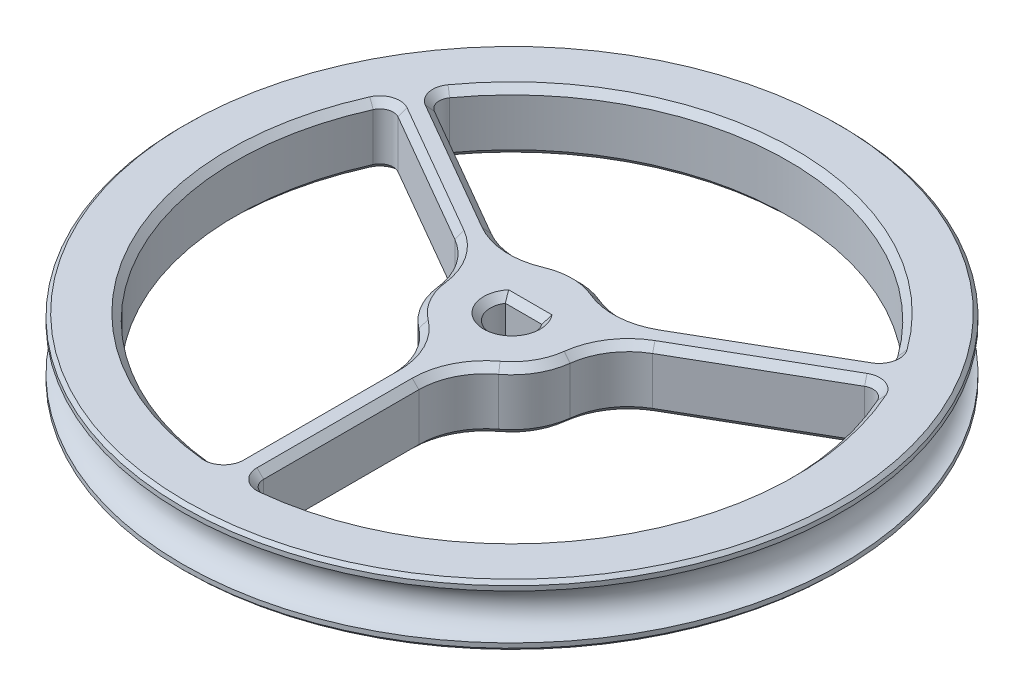
from build123d import *

# Parameters (mm, degrees)
SKETCH1_R           = 24.765
BOSS_EXTRUDE1_DEPTH = 4.572
SKETCH2_R           = 1.7145
CUT_EXTRUDE1_DEPTH  = 36.320159031
CUT_EXTRUDE2_DEPTH  = 36.320159031
CIRPATTERN1_COUNT   = 3
FILLET1_R           = 5
FILLET4_R           = 1
CHAMFER1_SIZE       = 0.5
CHAMFER2_SIZE       = 0.5
CHAMFER3_SIZE       = 0.25


with BuildPart() as part:
    # Sketch1 → Boss-Extrude1 (new body)
    with BuildSketch(Plane(origin=(0, 0, 0), x_dir=(1, 0, 0), z_dir=(0, 1, 0))):
        with Locations(Location((0, 0, 0), (0, 0, 270))):
            Circle(SKETCH1_R)
    extrude(amount=BOSS_EXTRUDE1_DEPTH)

    # Sketch2 → Cut-Revolve1 (revolve, cut)
    with BuildSketch(Plane(origin=(0, 0, 0), x_dir=(0, 0, -1), z_dir=(1, 0, 0))):
        with Locations((25.065, 2.286)):
            Circle(SKETCH2_R)
    revolve(axis=Axis((0, 0, 0), (0, 1, 0)), mode=Mode.SUBTRACT)

    # Sketch3 → Cut-Extrude1 (cut, through all)
    with BuildSketch(Plane(origin=(0, 4.572, 0), x_dir=(1, 0, 0), z_dir=(0, 1, 0))):
        with BuildLine():
            Line((1.372953022, 0.873), (-1.372953022, 0.873))
            ThreePointArc((-1.372953022, 0.873), (0, -1.627), (1.372953022, 0.873))
        make_face()
    extrude(amount=-CUT_EXTRUDE1_DEPTH, mode=Mode.SUBTRACT)

    # Sketch4 → Cut-Extrude2 (cut, through all)
    with BuildSketch(Plane(origin=(0, 4.572, 0), x_dir=(1, 0, 0), z_dir=(0, 1, 0))):
        with BuildLine():
            Line((3.742640687, 3.315515147), (17.462152397, 11.236478926))
            ThreePointArc((17.462152397, 11.236478926), (0, 20.765), (-17.462152397, 11.236478926))
            Line((-17.462152397, 11.236478926), (-3.742640687, 3.315515147))
            ThreePointArc((-3.742640687, 3.315515147), (0, 5), (3.742640687, 3.315515147))
        make_face()
    cut_extrude2 = extrude(amount=-CUT_EXTRUDE2_DEPTH, mode=Mode.SUBTRACT)

    # CirPattern1: Cut-Extrude2 ×3 about axis
    cirpattern1_axis = Axis((0, 0, 0), (0, 1, 0))
    for i in range(1, CIRPATTERN1_COUNT):
        add(cut_extrude2.rotate(cirpattern1_axis, i * 360 / CIRPATTERN1_COUNT), mode=Mode.SUBTRACT)

    # Fillet1
    fillet1_edges = [part.edges().sort_by_distance(p)[0] for p in [
        (3.742640687, 2.286, -3.315515147),
        (-3.742640687, 2.286, -3.315515147),
        (1, 2.286, 4.898979486),
        (4.742640687, 2.286, -1.583464339),
        (-4.742640687, 2.286, -1.583464339),
        (-1, 2.286, 4.898979486),
    ]]
    fillet(fillet1_edges, radius=FILLET1_R)

    # Fillet4
    fillet4_edges = [part.edges().sort_by_distance(p)[0] for p in [
        (-17.462152397, 2.286, -11.236478926),
        (17.462152397, 2.286, -11.236478926),
        (18.462152397, 2.286, -9.504428118),
        (1, 2.286, 20.740907044),
        (-1, 2.286, 20.740907044),
        (-18.462152397, 2.286, -9.504428118),
    ]]
    fillet(fillet4_edges, radius=FILLET4_R)

    # Chamfer1
    chamfer1_edges = [part.edges().sort_by_distance(p)[0] for p in [
        (0, 0, -0.873),
        (0, 0, 1.627),
        (0, 4.572, -0.873),
        (0, 4.572, 1.627),
    ]]
    chamfer(chamfer1_edges, length=CHAMFER1_SIZE)

    # Chamfer2
    chamfer2_edges = [part.edges().sort_by_distance(p)[0] for p in [
        (0, 4.572, -20.765),
        (0, 0, -20.765),
        (12.47866882, 4.572, -6.049862264),
        (12.47866882, 0, -6.049862264),
        (17.98301751, 4.572, 10.3825),
        (17.98301751, 0, 10.3825),
        (-17.98301751, 4.572, 10.3825),
        (-17.98301751, 0, 10.3825),
        (-11.47866882, 4.572, -7.781913072),
        (-11.47866882, 0, -7.781913072),
        (-1, 4.572, 13.831775336),
        (-1, 0, 13.831775336),
        (17.006931622, 4.572, -11.354272778),
        (17.006931622, 0, -11.354272778),
        (18.336554478, 4.572, -9.051298436),
        (18.336554478, 0, -9.051298436),
        (-18.336554478, 4.572, -9.051298436),
        (-18.336554478, 0, -9.051298436),
        (-17.006931622, 4.572, -11.354272778),
        (-17.006931622, 0, -11.354272778),
        (1.329622856, 4.572, 20.405571214),
        (1.329622856, 0, 20.405571214),
        (-1.329622856, 4.572, 20.405571214),
        (-1.329622856, 0, 20.405571214),
        (11.47866882, 4.572, -7.781913072),
        (11.47866882, 0, -7.781913072),
        (0, 4.572, -5),
        (0, 0, -5),
        (4.330127019, 4.572, 2.5),
        (4.330127019, 0, 2.5),
        (1, 4.572, 13.831775336),
        (1, 0, 13.831775336),
        (-4.330127019, 4.572, 2.5),
        (-4.330127019, 0, 2.5),
        (-12.47866882, 4.572, -6.049862264),
        (-12.47866882, 0, -6.049862264),
        (4.227779535, 4.572, -4.205135088),
        (4.227779535, 0, -4.205135088),
        (-4.227779535, 4.572, -4.205135088),
        (-4.227779535, 0, -4.205135088),
        (5.75564358, 4.572, -1.558796935),
        (5.75564358, 0, -1.558796935),
        (1.527864045, 4.572, 5.763932023),
        (1.527864045, 0, 5.763932023),
        (-1.527864045, 4.572, 5.763932023),
        (-1.527864045, 0, 5.763932023),
        (-5.75564358, 4.572, -1.558796935),
        (-5.75564358, 0, -1.558796935),
    ]]
    chamfer(chamfer2_edges, length=CHAMFER2_SIZE)

    # Chamfer3
    chamfer3_edges = [part.edges().sort_by_distance(p)[0] for p in [
        (0, 0, -24.765),
        (0, 4.572, -24.765),
    ]]
    chamfer(chamfer3_edges, length=CHAMFER3_SIZE)


solid = part.part
